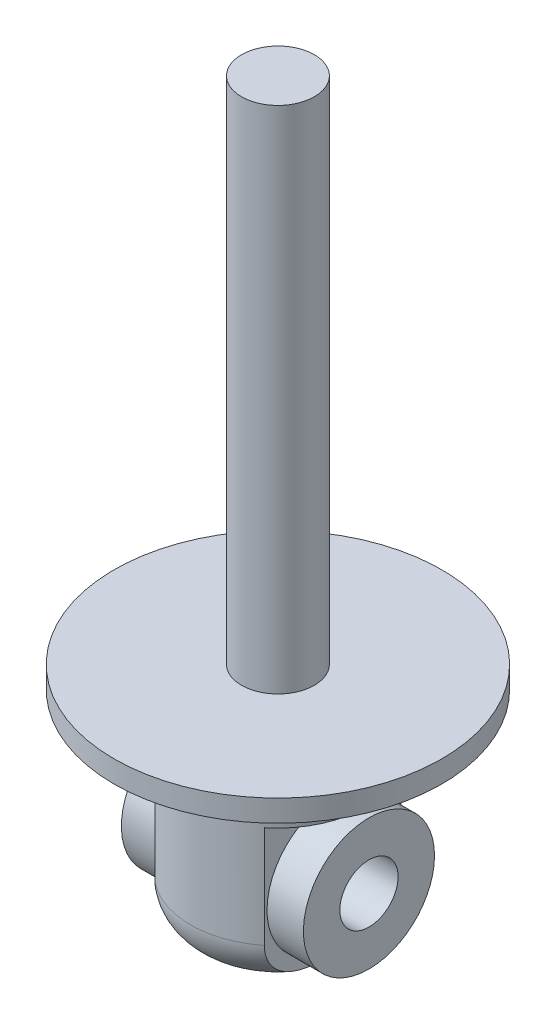
from build123d import *
from build123d.topology import SkipClean

# Parameters (mm, degrees)
SKETCH2_R               = 22.5
BOSS_EXTRUDE1_DEPTH     = 3
SKETCH4_R               = 5
BOSS_EXTRUDE2_DEPTH     = 70
SKETCH5_R               = 12
BOSS_EXTRUDE3_DEPTH     = 28
FILLET1_R               = 6
CUT_EXTRUDE1_DEPTH      = 80.633535649
CUT_EXTRUDE1_DEPTH_BACK = 80.633535649
SKETCH6_W               = 19
SKETCH6_H               = 20
SKETCH7_R               = 4
CUT_EXTRUDE2_DEPTH      = 83.068568892
SKETCH8_R               = 9
SKETCH8_R_2             = 4
BOSS_EXTRUDE4_DEPTH     = 12.5


with BuildPart() as part:
    # Sketch2 → Boss-Extrude1 (new body)
    with BuildSketch(Plane(origin=(0, 0, 0), x_dir=(1, 0, 0), z_dir=(0, 1, 0))):
        with Locations(Location((0, 0, 0), (0, 0, 270))):
            Circle(SKETCH2_R)
    extrude(amount=BOSS_EXTRUDE1_DEPTH)

    # Sketch4 → Boss-Extrude2 (add)
    with BuildSketch(Plane(origin=(0, 3, 0), x_dir=(1, 0, 0), z_dir=(0, 1, 0))):
        with Locations(Location((0, 0, 0), (0, 0, 270))):
            Circle(SKETCH4_R)
    extrude(amount=BOSS_EXTRUDE2_DEPTH)

    # Sketch5 → Boss-Extrude3 (add)
    with BuildSketch(Plane.XZ):
        with Locations(Location((0, 0, 0), (0, 0, 270))):
            Circle(SKETCH5_R)
    extrude(amount=BOSS_EXTRUDE3_DEPTH)

    # Fillet1
    fillet1_edges = [part.edges().sort_by_distance(p)[0] for p in [
        (0, -28, 12),
    ]]
    fillet(fillet1_edges, radius=FILLET1_R)

    # Sketch6 → Cut-Extrude1 (cut, two sides: drawn at the far end of the back side and taken through both)
    with BuildSketch(Plane.XY.offset(-CUT_EXTRUDE1_DEPTH_BACK)):
        with Locations((17, -18)):
            Rectangle(SKETCH6_W, SKETCH6_H)
        with Locations((-17, -18)):
            Rectangle(SKETCH6_W, SKETCH6_H)
    extrude(amount=CUT_EXTRUDE1_DEPTH + CUT_EXTRUDE1_DEPTH_BACK, mode=Mode.SUBTRACT)

    # Sketch7 → Cut-Extrude2 (cut, through all)
    with BuildSketch(Plane(origin=(7.5, 0, 0), x_dir=(0, 0, -1), z_dir=(1, 0, 0))):
        with Locations(Location((0, -18, 0), (0, 0, 90))):
            Circle(SKETCH7_R)
    extrude(amount=-CUT_EXTRUDE2_DEPTH, mode=Mode.SUBTRACT)

    # Sketch8 → Boss-Extrude4 (add, symmetric)
    with SkipClean():  # the faces are left unmerged after this step: merging them gives an invalid solid
        with BuildSketch(Plane(origin=(0, 0, 0), x_dir=(0, 0, -1), z_dir=(1, 0, 0))):
            with Locations(Location((0, -18, 0), (0, 0, 270))):
                Circle(SKETCH8_R)
            with Locations((0, -18)):
                Circle(SKETCH8_R_2, mode=Mode.SUBTRACT)
        extrude(amount=BOSS_EXTRUDE4_DEPTH, both=True)


solid = part.part
